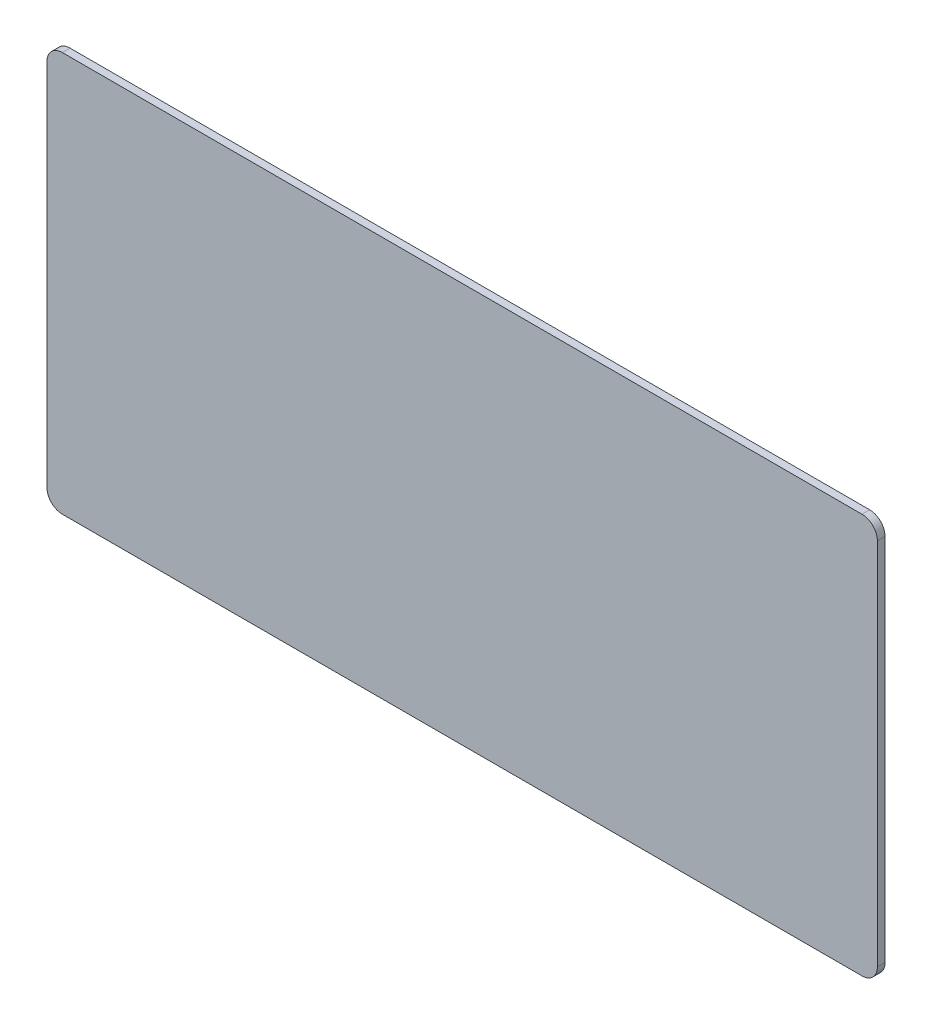
from build123d import *

# Parameters (mm, degrees)
SKETCH1_W           = 540
SKETCH1_H           = 260
BOSS_EXTRUDE1_DEPTH = 5
FILLET1_R           = 10


with BuildPart() as part:
    # Sketch1 → Boss-Extrude1 (new body)
    with BuildSketch(Plane.XY):
        Rectangle(SKETCH1_W, SKETCH1_H)
    extrude(amount=BOSS_EXTRUDE1_DEPTH)

    # Fillet1
    fillet1_edges = [part.edges().sort_by_distance(p)[0] for p in [
        (270, -130, 2.5),
        (-270, -130, 2.5),
        (-270, 130, 2.5),
        (270, 130, 2.5),
    ]]
    fillet(fillet1_edges, radius=FILLET1_R)


solid = part.part
